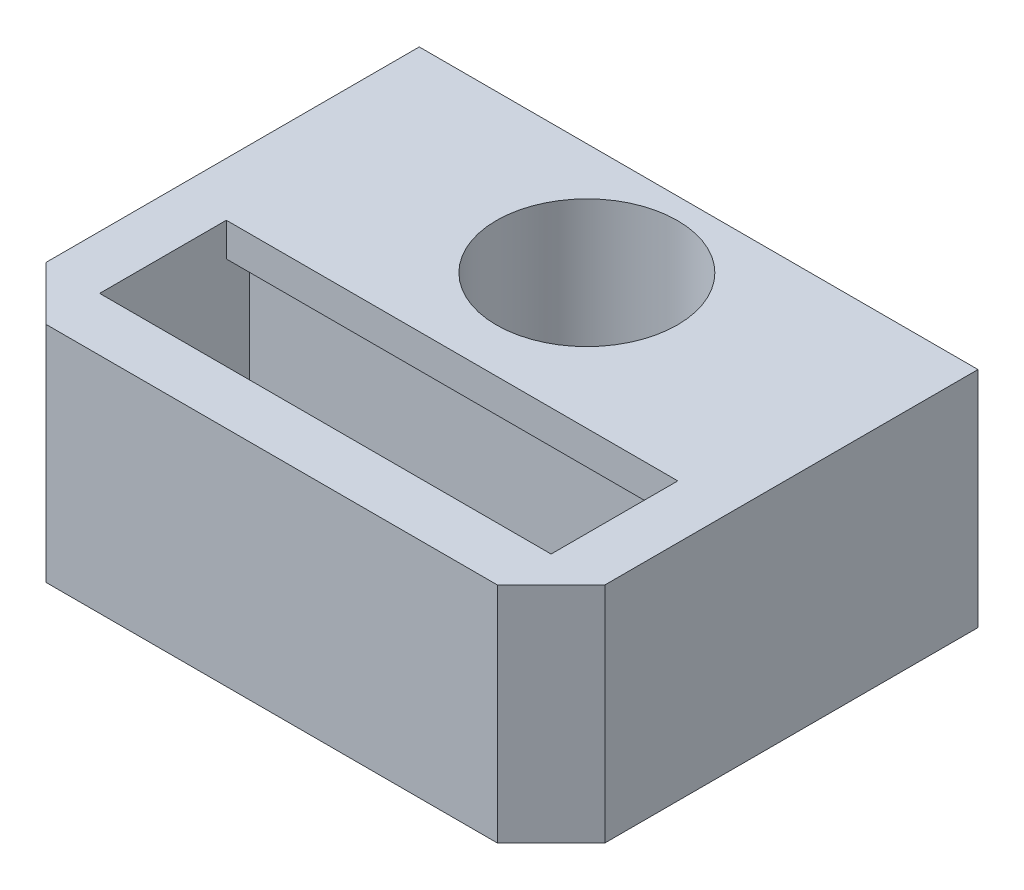
from build123d import *

# Parameters (mm, degrees)
ESBO_O1_W                = 25
ESBO_O1_H                = 10
ESBO_O1_R                = 4.05
RESSALTO_EXTRUS_O1_DEPTH = 10
RESSALTO_EXTRUS_O2_DEPTH = 10
RESSALTO_EXTRUS_O3_REACH = 32.394
ESBO_O3_W                = 1.752399307
ESBO_O3_H                = 1.5


with BuildPart() as part:
    # Esboço1 → Ressalto-extrusão1 (new body)
    with BuildSketch(Plane(origin=(0, 0, 0), x_dir=(1, 0, 0), z_dir=(0, 1, 0))):
        Rectangle(ESBO_O1_W, ESBO_O1_H)
        with Locations(Location((0, 0, 0), (0, 0, 270))):
            Circle(ESBO_O1_R, mode=Mode.SUBTRACT)
    extrude(amount=RESSALTO_EXTRUS_O1_DEPTH)

    # Esboço2 → Ressalto-extrusão2 (add)
    with BuildSketch(Plane.XZ):
        Polygon((-12.5, 5), (-12.5, 11.7), (-10.1, 14.1), (10.1, 14.1), (12.5, 11.7), (12.5, 5), (10.1, 5), (10.1, 11.7), (-10.1, 11.7), (-10.1, 5), align=None)
    extrude(amount=-RESSALTO_EXTRUS_O2_DEPTH)

    # Esboço3 → Ressalto-extrusão3 (add, up to next)
    with BuildSketch(Plane.ZY.offset(12.5), mode=Mode.PRIVATE) as ressalto_extrus_o3_sk1:
        with Locations((5.154994999, 9.25)):
            Rectangle(ESBO_O3_W, ESBO_O3_H)
    ressalto_extrus_o3_tool1 = extrude(ressalto_extrus_o3_sk1.sketch, amount=-RESSALTO_EXTRUS_O3_REACH, mode=Mode.PRIVATE) - part.part
    add(ressalto_extrus_o3_tool1.solids().sort_by_distance((-12.5, 9.25, 5.154995))[0])


solid = part.part
